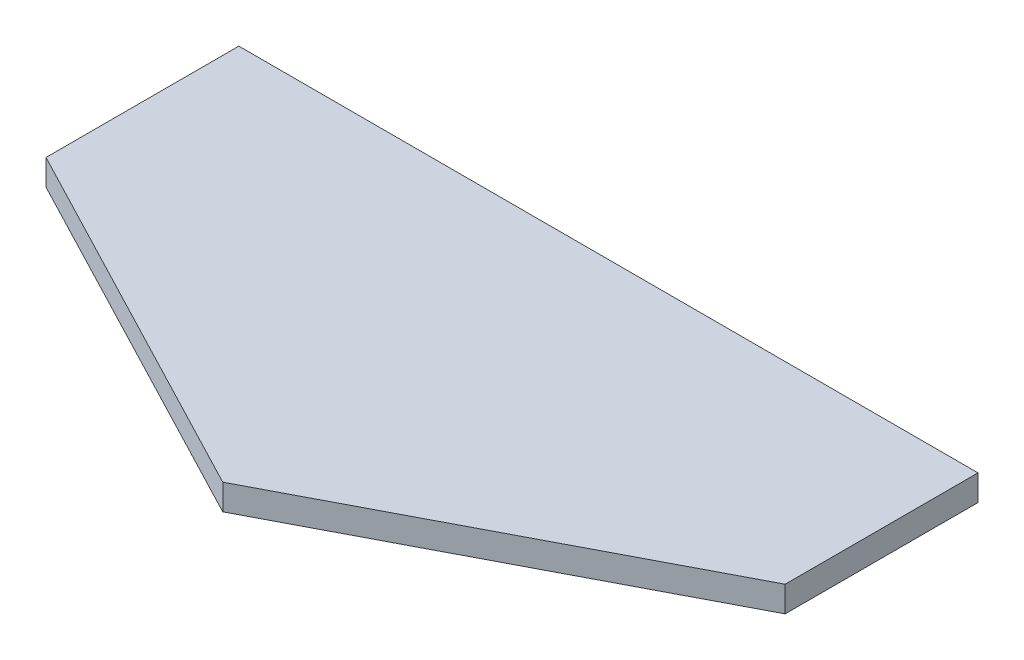
from build123d import *

# Parameters (mm, degrees)
SKETCH1_W           = 115
SKETCH1_H           = 30
BOSS_EXTRUDE1_DEPTH = 4


with BuildPart() as part:
    # Sketch1 → Boss-Extrude1 (new body)
    with BuildSketch(Plane(origin=(0, 0, 0), x_dir=(1, 0, 0), z_dir=(0, 1, 0))):
        Polygon((57.5, -30), (0, -30), (57.5, -60), align=None)
        with Locations((57.5, -15)):
            Rectangle(SKETCH1_W, SKETCH1_H)
        Polygon((57.5, -30), (57.5, -60), (115, -30), align=None)
    extrude(amount=BOSS_EXTRUDE1_DEPTH)


solid = part.part
